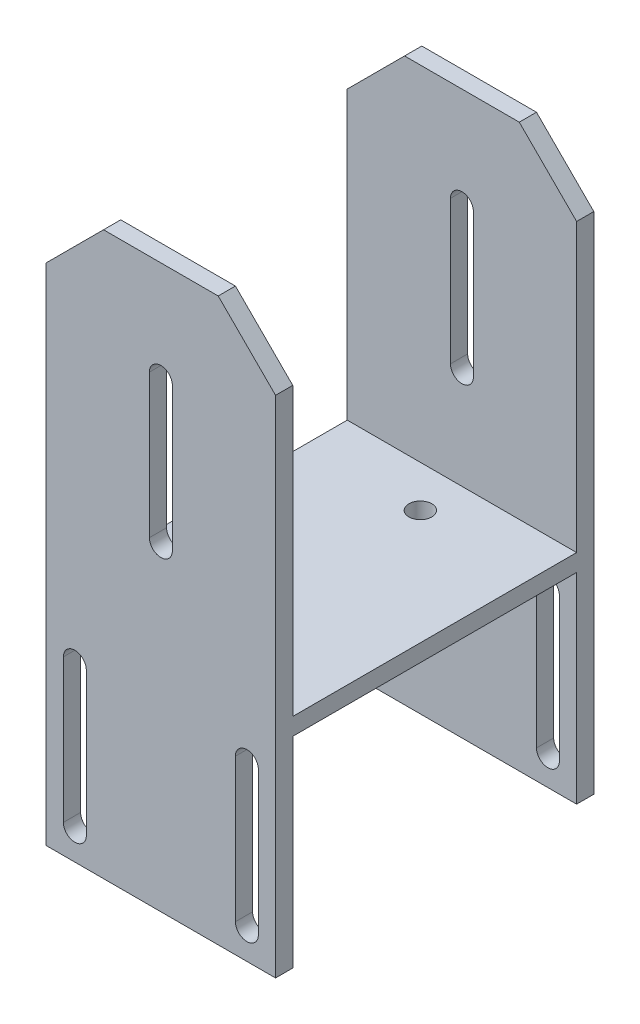
from build123d import *

# Parameters (mm, degrees)
SALIENTE_EXTRUIR1_DEPTH = 40
CORTAR_EXTRUIR1_DEPTH   = 79
CHAFL_N1_SIZE           = 10
CROQUIS6_R              = 2
CORTAR_EXTRUIR2_DEPTH   = 9


with BuildPart() as part:
    # Croquis1 → Saliente-Extruir1 (new body)
    with BuildSketch(Plane(origin=(0, 0, 0), x_dir=(0, 0, -1), z_dir=(1, 0, 0))):
        Polygon((0, 0), (0, 98), (3, 98), (3, 38), (52.5, 38), (52.5, 98), (55.5, 98), (55.5, 0), (52.5, 0), (52.5, 35), (3, 35), (3, 0), align=None)
    extrude(amount=SALIENTE_EXTRUIR1_DEPTH)

    # Croquis3 → Cortar-Extruir1 (cut)
    with BuildSketch(Plane.XY):
        with BuildLine():
            Line((18, 80.5), (18, 55.5))
            ThreePointArc((18, 55.5), (20, 53.5), (22, 55.5))
            Line((22, 55.5), (22, 80.5))
            ThreePointArc((22, 80.5), (20, 82.5), (18, 80.5))
        make_face()
        with BuildLine():
            Line((3, 30), (3, 5))
            ThreePointArc((3, 5), (5, 3), (7, 5))
            Line((7, 5), (7, 30))
            ThreePointArc((7, 30), (5, 32), (3, 30))
        make_face()
        with BuildLine():
            Line((33, 30), (33, 5))
            ThreePointArc((33, 5), (35, 3), (37, 5))
            Line((37, 5), (37, 30))
            ThreePointArc((37, 30), (35, 32), (33, 30))
        make_face()
    extrude(amount=-CORTAR_EXTRUIR1_DEPTH, mode=Mode.SUBTRACT)

    # Chaflán1
    chafl_n1_edges = [part.edges().sort_by_distance(p)[0] for p in [
        (0, 98, -1.5),
        (0, 98, -54),
        (40, 98, -54),
        (40, 98, -1.5),
    ]]
    chamfer(chafl_n1_edges, length=CHAFL_N1_SIZE)

    # Croquis6 → Cortar-Extruir2 (cut)
    with BuildSketch(Plane(origin=(0, 38, 0), x_dir=(1, 0, 0), z_dir=(0, 1, 0))):
        with Locations(Location((20, 45.25, 0), (0, 0, 270))):
            Circle(CROQUIS6_R)
        with Locations(Location((20, 10.25, 0), (0, 0, 270))):
            Circle(CROQUIS6_R)
    extrude(amount=-CORTAR_EXTRUIR2_DEPTH, mode=Mode.SUBTRACT)


solid = part.part
